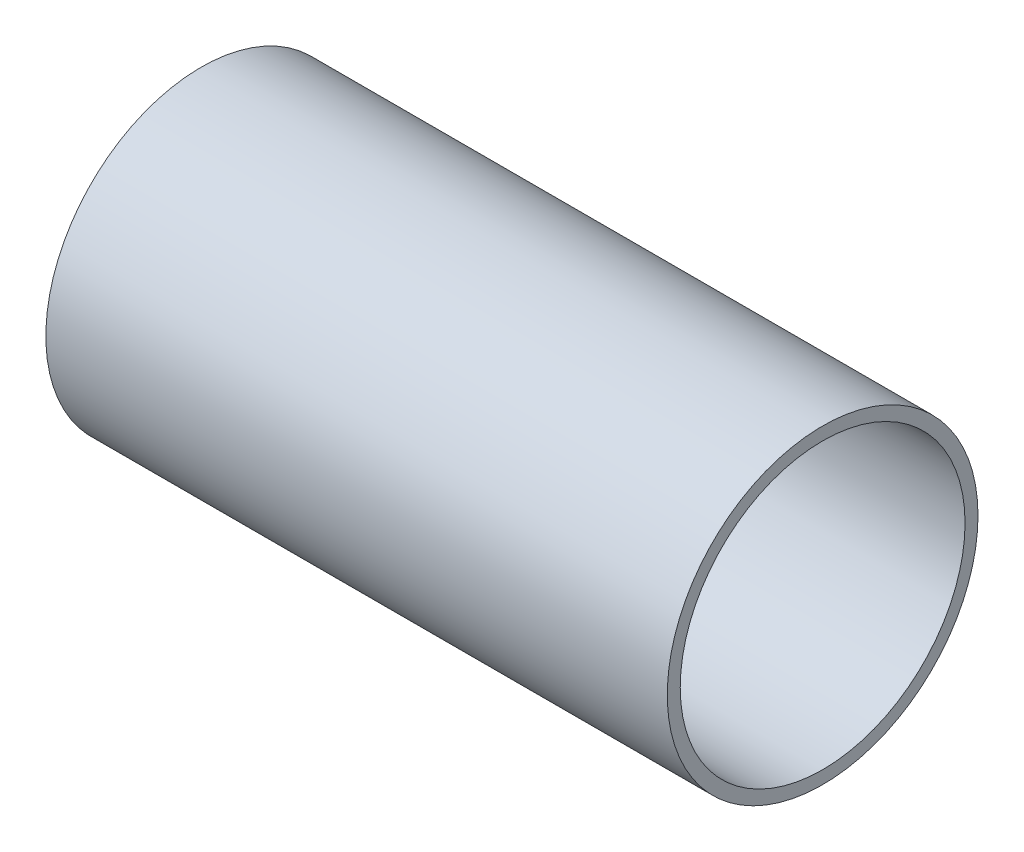
from build123d import *

# Parameters (mm, degrees)
BOSS_EXTRUDE1_DEPTH      = 152.4
BOSS_EXTRUDE1_DEPTH_BACK = 152.4
SKETCH1_R                = 76.2
SKETCH1_R_2              = 69.85


with BuildPart() as part:
    # Sketch1 → Boss-Extrude1 (new, two sides: drawn at the far end of the back side and taken through both)
    with BuildSketch(Plane(origin=(0, 0, 0), x_dir=(0, 0, -1), z_dir=(1, 0, 0)).offset(-BOSS_EXTRUDE1_DEPTH_BACK)):
        Circle(SKETCH1_R)
        Circle(SKETCH1_R_2, mode=Mode.SUBTRACT)
    extrude(amount=BOSS_EXTRUDE1_DEPTH + BOSS_EXTRUDE1_DEPTH_BACK)


solid = part.part
